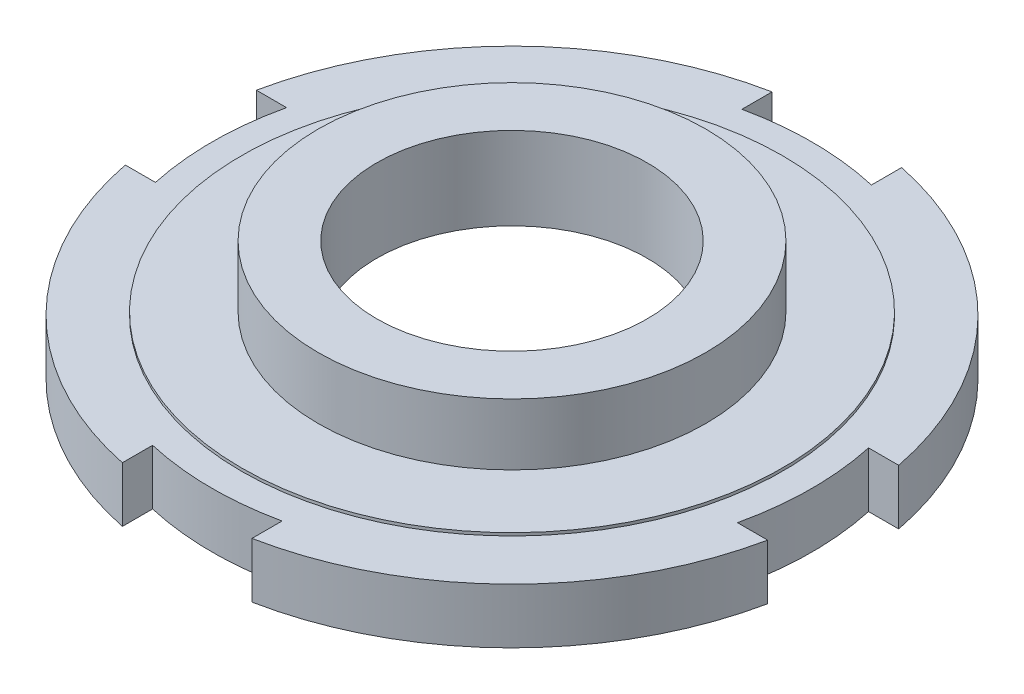
from build123d import *

# Parameters (mm, degrees)
SKETCH1_R           = 13.97
BOSS_EXTRUDE2_DEPTH = 6.0000007
CUT_EXTRUDE1_DEPTH  = 3.81
SKETCH3_R           = 27.94
CUT_EXTRUDE2_DEPTH  = 0.3
SKETCH5_R           = 20.01
SKETCH5_R_2         = 13.97
BOSS_EXTRUDE3_DEPTH = 6.35
CUT_EXTRUDE3_START  = -0.3
SKETCH6_R           = 50.8
SKETCH6_R_2         = 27.94
CUT_EXTRUDE3_DEPTH  = 0.3


with BuildPart() as part:
    # Sketch1 → Boss-Extrude2 (new body)
    with BuildSketch(Plane(origin=(0, 0, 0), x_dir=(1, 0, 0), z_dir=(0, 1, 0))):
        with BuildLine():
            Line((30.289899368, 6.5405), (33.401663967, 6.5405))
            ThreePointArc((33.401663967, 6.5405), (24.204111991, 23.929276184), (6.9215, 33.32479758))
            Line((6.9215, 33.32479758), (6.9215, 30.205115159))
            ThreePointArc((6.9215, 30.205115159), (0.195159782, 30.987385444), (-6.5405, 30.289899368))
            Line((-6.5405, 30.289899368), (-6.5405, 33.401663967))
            ThreePointArc((-6.5405, 33.401663967), (-23.929276184, 24.204111991), (-33.32479758, 6.9215))
            Line((-33.32479758, 6.9215), (-30.205115159, 6.9215))
            ThreePointArc((-30.205115159, 6.9215), (-30.987385444, 0.195159782), (-30.289899368, -6.5405))
            Line((-30.289899368, -6.5405), (-33.401663967, -6.5405))
            ThreePointArc((-33.401663967, -6.5405), (-24.204111991, -23.929276184), (-6.9215, -33.32479758))
            Line((-6.9215, -33.32479758), (-6.9215, -30.205115159))
            ThreePointArc((-6.9215, -30.205115159), (-0.195159782, -30.987385444), (6.5405, -30.289899368))
            Line((6.5405, -30.289899368), (6.5405, -33.401663967))
            ThreePointArc((6.5405, -33.401663967), (23.929276184, -24.204111991), (33.32479758, -6.9215))
            Line((33.32479758, -6.9215), (30.205115159, -6.9215))
            ThreePointArc((30.205115159, -6.9215), (30.987385444, -0.195159782), (30.289899368, 6.5405))
        make_face()
        Circle(SKETCH1_R, mode=Mode.SUBTRACT)
    extrude(amount=BOSS_EXTRUDE2_DEPTH)

    # Sketch2 → Cut-Extrude1 (cut)
    with BuildSketch(Plane.XZ):
        with BuildLine():
            Line((17.377665752, -10.033), (-0.286554615, -40.628327152))
            ThreePointArc((-0.286554615, -40.628327152), (-2.416432138, -40.557415308), (-4.539661745, -40.374924792))
            Line((-4.539661745, -40.374924792), (8.196212586, -18.315743371))
            ThreePointArc((8.196212586, -18.315743371), (-13.440862054, 14.899247741), (17.377665752, -10.033))
        make_face()
    extrude(amount=-CUT_EXTRUDE1_DEPTH, mode=Mode.SUBTRACT)

    # Sketch3 → Cut-Extrude2 (cut)
    with BuildSketch(Plane.XZ):
        Circle(SKETCH3_R)
    extrude(amount=-CUT_EXTRUDE2_DEPTH, mode=Mode.SUBTRACT)

    # Sketch5 → Boss-Extrude3 (add)
    with BuildSketch(Plane(origin=(0, 6.0000007, 0), x_dir=(1, 0, 0), z_dir=(0, 1, 0))):
        Circle(SKETCH5_R)
        Circle(SKETCH5_R_2, mode=Mode.SUBTRACT)
    extrude(amount=BOSS_EXTRUDE3_DEPTH)

    # Sketch6 → Cut-Extrude3 (cut)
    with BuildSketch(Plane(origin=(0, 6.0000007, 0), x_dir=(1, 0, 0), z_dir=(0, 1, 0)).offset(CUT_EXTRUDE3_START)):
        Circle(SKETCH6_R)
        Circle(SKETCH6_R_2, mode=Mode.SUBTRACT)
    extrude(amount=CUT_EXTRUDE3_DEPTH, mode=Mode.SUBTRACT)


solid = part.part
